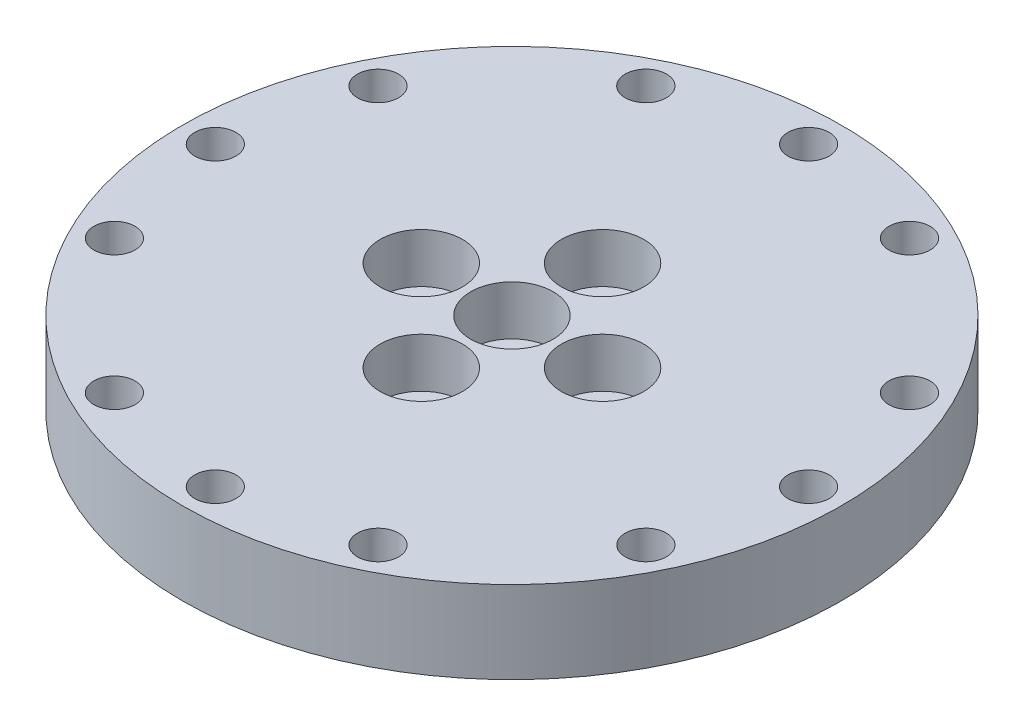
from build123d import *

# Parameters (mm, degrees)
SKETCH1_R           = 21.5
SKETCH1_R_2         = 17.5
BOSS_EXTRUDE1_DEPTH = 9
SKETCH3_R           = 40
SKETCH3_R_2         = 3.05
SKETCH3_R_3         = 2.5
SKETCH3_R_4         = 2.496925047
SKETCH3_R_5         = 2.499529996
SKETCH3_R_6         = 2.502831222
SKETCH3_R_7         = 2.503585157
BOSS_EXTRUDE2_DEPTH = 10
CUT_EXTRUDE1_START  = -6
SKETCH6_R           = 5
SKETCH6_R_2         = 3.05
CUT_EXTRUDE1_DEPTH  = 6


with BuildPart() as part:
    # Sketch1 → Boss-Extrude1 (new body)
    with BuildSketch(Plane(origin=(0, 0, 0), x_dir=(1, 0, 0), z_dir=(0, 1, 0))):
        with Locations(Location((0, 0, 0), (0, 0, 270))):
            Circle(SKETCH1_R)
        with Locations(Location((0, 0, 0), (0, 0, 270))):
            Circle(SKETCH1_R_2, mode=Mode.SUBTRACT)
    extrude(amount=BOSS_EXTRUDE1_DEPTH)

    # Sketch3 → Boss-Extrude2 (add)
    with BuildSketch(Plane(origin=(0, 9, 0), x_dir=(1, 0, 0), z_dir=(0, 1, 0))):
        with Locations(Location((0, 0, 0), (0, 0, 270))):
            Circle(SKETCH3_R)
        with Locations(Location((0, 0, 0), (0, 0, 270))):
            Circle(SKETCH3_R_2, mode=Mode.SUBTRACT)
        with Locations(Location((-11, 0, 0), (0, 0, 270))):
            Circle(SKETCH3_R_2, mode=Mode.SUBTRACT)
        with Locations(Location((0, -11, 0), (0, 0, 270))):
            Circle(SKETCH3_R_2, mode=Mode.SUBTRACT)
        with Locations(Location((11, 0, 0), (0, 0, 270))):
            Circle(SKETCH3_R_2, mode=Mode.SUBTRACT)
        with Locations(Location((0, 11, 0), (0, 0, 270))):
            Circle(SKETCH3_R_2, mode=Mode.SUBTRACT)
        with Locations(Location((0, 36, 0), (0, 0, 270))):
            Circle(SKETCH3_R_3, mode=Mode.SUBTRACT)
        with Locations(Location((-32.251083055, 15.995863271, 0), (0, 0, 270))):
            Circle(SKETCH3_R_4, mode=Mode.SUBTRACT)
        with Locations(Location((-32.251083055, -15.995863271, 0), (0, 0, 270))):
            Circle(SKETCH3_R_5, mode=Mode.SUBTRACT)
        with Locations(Location((0, -36, 0), (0, 0, 270))):
            Circle(SKETCH3_R_3, mode=Mode.SUBTRACT)
        with Locations(Location((36, 0, 0), (0, 0, 270))):
            Circle(SKETCH3_R_3, mode=Mode.SUBTRACT)
        with Locations(Location((32.251083055, 15.995863271, 0), (0, 0, 270))):
            Circle(SKETCH3_R_6, mode=Mode.SUBTRACT)
        with Locations(Location((32.251083055, -15.995863271, 0), (0, 0, 270))):
            Circle(SKETCH3_R_3, mode=Mode.SUBTRACT)
        with Locations(Location((-16, 32.253585157, 0), (0, 0, 270))):
            Circle(SKETCH3_R_7, mode=Mode.SUBTRACT)
        with Locations(Location((16, 32.253585157, 0), (0, 0, 270))):
            Circle(SKETCH3_R_7, mode=Mode.SUBTRACT)
        with Locations(Location((-16, -32.25, 0), (0, 0, 270))):
            Circle(SKETCH3_R_3, mode=Mode.SUBTRACT)
        with Locations(Location((16, -32.25, 0), (0, 0, 270))):
            Circle(SKETCH3_R_3, mode=Mode.SUBTRACT)
        with Locations(Location((-36, 0, 0), (0, 0, 270))):
            Circle(SKETCH3_R_3, mode=Mode.SUBTRACT)
    extrude(amount=BOSS_EXTRUDE2_DEPTH)

    # Sketch6 → Cut-Extrude1 (cut)
    # profile 1 of 5: a face of its own
    with BuildSketch(Plane(origin=(0, 19, 0), x_dir=(1, 0, 0), z_dir=(0, 1, 0)).offset(CUT_EXTRUDE1_START)):
        with Locations(Location((0, 11, 0), (0, 0, 270))):
            Circle(SKETCH6_R)
        with Locations(Location((0, 11, 0), (0, 0, 270))):
            Circle(SKETCH6_R_2, mode=Mode.SUBTRACT)
    # profile 2 of 5: a face of its own
    with BuildSketch(Plane(origin=(0, 19, 0), x_dir=(1, 0, 0), z_dir=(0, 1, 0)).offset(CUT_EXTRUDE1_START)):
        with Locations(Location((-11, 0, 0), (0, 0, 270))):
            Circle(SKETCH6_R)
        with Locations(Location((-11, 0, 0), (0, 0, 270))):
            Circle(SKETCH6_R_2, mode=Mode.SUBTRACT)
    # profile 3 of 5: a face of its own
    with BuildSketch(Plane(origin=(0, 19, 0), x_dir=(1, 0, 0), z_dir=(0, 1, 0)).offset(CUT_EXTRUDE1_START)):
        with Locations(Location((0, 0, 0), (0, 0, 270))):
            Circle(SKETCH6_R)
        with Locations(Location((0, 0, 0), (0, 0, 270))):
            Circle(SKETCH6_R_2, mode=Mode.SUBTRACT)
    # profile 4 of 5: a face of its own
    with BuildSketch(Plane(origin=(0, 19, 0), x_dir=(1, 0, 0), z_dir=(0, 1, 0)).offset(CUT_EXTRUDE1_START)):
        with Locations(Location((11, 0, 0), (0, 0, 270))):
            Circle(SKETCH6_R)
        with Locations(Location((11, 0, 0), (0, 0, 270))):
            Circle(SKETCH6_R_2, mode=Mode.SUBTRACT)
    # profile 5 of 5: a face of its own
    with BuildSketch(Plane(origin=(0, 19, 0), x_dir=(1, 0, 0), z_dir=(0, 1, 0)).offset(CUT_EXTRUDE1_START)):
        with Locations(Location((0, -11, 0), (0, 0, 270))):
            Circle(SKETCH6_R)
        with Locations(Location((0, -11, 0), (0, 0, 270))):
            Circle(SKETCH6_R_2, mode=Mode.SUBTRACT)
    extrude(amount=CUT_EXTRUDE1_DEPTH, mode=Mode.SUBTRACT)


solid = part.part
